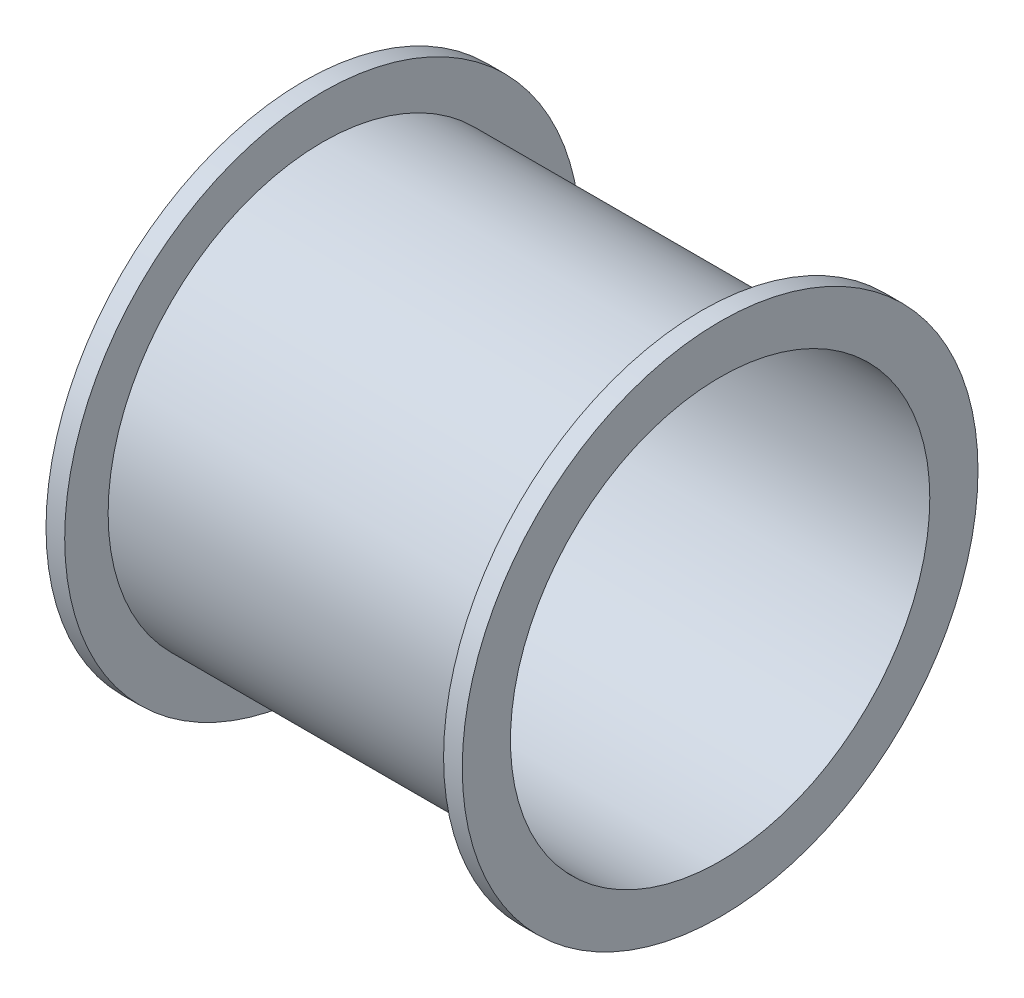
from build123d import *

# Parameters (mm, degrees)
HELIX_CIRCLES_R     = 58.3
HELIX_CIRCLES_R_2   = 57
BOSS_EXTRUDE1_DEPTH = 103
SKETCH50_R          = 70.1085
BOSS_EXTRUDE2_DEPTH = 5.08
SKETCH58_R          = 70.104
SKETCH58_R_2        = 57
BOSS_EXTRUDE6_DEPTH = 5.08
SKETCH59_R          = 17.235790132
BOSS_EXTRUDE7_DEPTH = 7.62


with BuildPart() as part:
    # Helix_Circles → Boss-Extrude1 (new body)
    with BuildSketch(Plane(origin=(0, 0, 0), x_dir=(0, 0, -1), z_dir=(1, 0, 0))):
        Circle(HELIX_CIRCLES_R)
        Circle(HELIX_CIRCLES_R_2, mode=Mode.SUBTRACT)
    extrude(amount=BOSS_EXTRUDE1_DEPTH)

    # Sketch50 → Boss-Extrude2 (add)
    with BuildSketch(Plane(origin=(0, 0, 0), x_dir=(0, 0, -1), z_dir=(1, 0, 0))):
        Circle(SKETCH50_R)
    extrude(amount=-BOSS_EXTRUDE2_DEPTH)

    # Sketch58 → Boss-Extrude6 (add)
    with BuildSketch(Plane(origin=(103, 0, 0), x_dir=(0, 0, -1), z_dir=(1, 0, 0))):
        Circle(SKETCH58_R)
        Circle(SKETCH58_R_2, mode=Mode.SUBTRACT)
    extrude(amount=BOSS_EXTRUDE6_DEPTH)

    # Sketch59 → Boss-Extrude7 (add)
    with BuildSketch(Plane(origin=(0, 0, 0), x_dir=(0, 0, -1), z_dir=(1, 0, 0))):
        with Locations(Location((-25.38017448, 0, 0), (0, 0, 180))):
            Circle(SKETCH59_R)
        with Locations(Location((25.38017448, 0, 0), (0, 0, 180))):
            Circle(SKETCH59_R)
    extrude(amount=BOSS_EXTRUDE7_DEPTH)


solid = part.part
